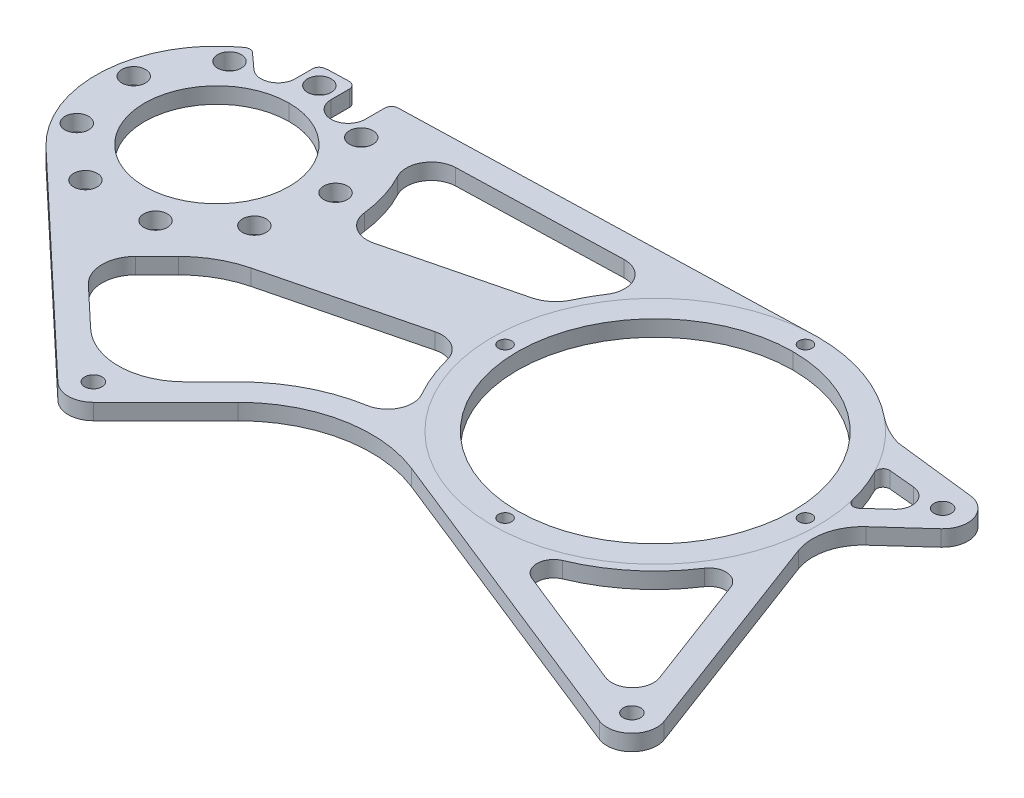
from build123d import *

# Parameters (mm, degrees)
MASTER_SKETCH_R       = 52.451
MASTER_SKETCH_R_2     = 9.525
MASTER_SKETCH_R_3     = 45.974
MASTER_SKETCH_R_4     = 27.4955
MASTER_SKETCH_R_5     = 6.5
BOSS_EXTRUDE2_DEPTH   = 3.048
F_5_0MM_DOWEL_HOLE1_D = 5
CIRPATTERN4_COUNT     = 4
M6_CLEARANCE_HOLE4_D  = 6.6
M8_CLEARANCE_HOLE1_D  = 9
CIRPATTERN3_COUNT     = 9
CUT_EXTRUDE2_DEPTH    = 284.854467488
CUT_EXTRUDE3_DEPTH    = 284.854467488
FILLET1_R             = 2.54


with BuildPart() as part:
    # Master Sketch → Boss-Extrude2 (new, symmetric)
    # profile 1 of 5: a face of its own
    with BuildSketch(Plane(origin=(0, 0, 0), x_dir=(1, 0, 0), z_dir=(0, 1, 0))):
        with BuildLine():
            ThreePointArc((-8.636, 127), (-36.396097826, 84.787887478), (-86.152093601, 93.552952189))
            Line((-86.152093601, 93.552952189), (-6.534964144, 18.470363023))
            ThreePointArc((-6.534964144, 18.470363023), (-3.773598517, 34.145603423), (9.525, 25.4))
            ThreePointArc((9.525, 25.4), (8.799952547, 21.754940307), (6.735192091, 18.664807909))
            Line((6.735192091, 18.664807909), (34.255961574, 46.185577392))
            ThreePointArc((34.255961574, 46.185577392), (59.945142207, 60.02346539), (89.010077776, 57.44457682))
            Line((89.010077776, 57.44457682), (207.987004211, 9.951947906))
            ThreePointArc((207.987004211, 9.951947906), (204.851852042, 25.601533276), (220.43444462, 22.148779315))
            Line((220.43444462, 22.148779315), (189.716874265, 103.891447497))
            ThreePointArc((189.716874265, 103.891447497), (189.0323732, 115.067445458), (194.744907427, 124.697524629))
            Line((194.744907427, 124.697524629), (209.652959731, 138.231042786))
            ThreePointArc((209.652959731, 138.231042786), (194.181291125, 142.373055798), (204.353700493, 154.744429565))
            Line((204.353700493, 154.744429565), (173.100049306, 158.387997533))
            ThreePointArc((173.100049306, 158.387997533), (167.382597042, 160.73155253), (162.227355528, 164.138163067))
            ThreePointArc((162.227355528, 164.138163067), (143.898999717, 174.415513345), (123.19, 177.9778))
            Line((123.19, 177.9778), (-54.61, 172.974))
            ThreePointArc((-54.61, 172.974), (-22.101472842, 159.508527158), (-8.636, 127))
        make_face()
        with Locations(Location((123.19, 116.0018, 0), (0, 0, 90))):
            Circle(MASTER_SKETCH_R, mode=Mode.SUBTRACT)
    # profile 2 of 5: a face of its own
    with BuildSketch(Plane(origin=(0, 0, 0), x_dir=(1, 0, 0), z_dir=(0, 1, 0))):
        with Locations((0, 25.4)):
            Circle(MASTER_SKETCH_R_2)
    # profile 3 of 5: a face of its own
    with BuildSketch(Plane(origin=(0, 0, 0), x_dir=(1, 0, 0), z_dir=(0, 1, 0))):
        with Locations((211.518208908, 18.79820239)):
            Circle(MASTER_SKETCH_R_2)
    # profile 4 of 5: a face of its own
    with BuildSketch(Plane(origin=(0, 0, 0), x_dir=(1, 0, 0), z_dir=(0, 1, 0))):
        with Locations((203.2507406, 145.283504427)):
            Circle(MASTER_SKETCH_R_2)
    # profile 5 of 5: a face of its own
    with BuildSketch(Plane(origin=(0, 0, 0), x_dir=(1, 0, 0), z_dir=(0, 1, 0))):
        with Locations((-54.61, 127)):
            Circle(MASTER_SKETCH_R_3)
        with Locations(Location((-54.61, 127, 0), (0, 0, 90))):
            Circle(MASTER_SKETCH_R_4, mode=Mode.SUBTRACT)
        with Locations(Location((-67.94878559, 163.648012211, 0), (0, 0, 90))):
            Circle(MASTER_SKETCH_R_5, mode=Mode.SUBTRACT)
        with Locations(Location((-41.27121441, 163.648012211, 0), (0, 0, 90))):
            Circle(MASTER_SKETCH_R_5, mode=Mode.SUBTRACT)
    extrude(amount=BOSS_EXTRUDE2_DEPTH, both=True)

    # Ø5.0mm Dowel Hole1 (through all)
    with Locations(Plane(origin=(0, 3.048, 0), x_dir=(1, 0, 0), z_dir=(0, 1, 0))):
        with Locations((123.19, 173.1518)):
            f_5_0mm_dowel_hole1 = Hole(F_5_0MM_DOWEL_HOLE1_D / 2)

    # CirPattern4: Ø5.0mm Dowel Hole1 ×4 about axis
    cirpattern4_axis = Axis((123.19, 0, -116.0018), (0, 1, 0))
    for i in range(1, CIRPATTERN4_COUNT):
        add(f_5_0mm_dowel_hole1.rotate(cirpattern4_axis, i * 360 / CIRPATTERN4_COUNT), mode=Mode.SUBTRACT)

    # M6 Clearance Hole4 (through all)
    with Locations(Plane(origin=(0, 3.048, 0), x_dir=(1, 0, 0), z_dir=(0, 1, 0))):
        with Locations((203.2507406, 145.283504427), (211.518208908, 18.79820239), (0, 25.4)):
            Hole(M6_CLEARANCE_HOLE4_D / 2)

    # M8 Clearance Hole1 (through all)
    with Locations(Plane(origin=(0, 3.048, 0), x_dir=(1, 0, 0), z_dir=(0, 1, 0))):
        with Locations((-54.61, 166)):
            m8_clearance_hole1 = Hole(M8_CLEARANCE_HOLE1_D / 2)

    # CirPattern3: M8 Clearance Hole1 ×9 about axis
    cirpattern3_axis = Axis((-54.61, 0, -127), (0, 1, 0))
    for i in range(1, CIRPATTERN3_COUNT):
        add(m8_clearance_hole1.rotate(cirpattern3_axis, i * 360 / CIRPATTERN3_COUNT), mode=Mode.SUBTRACT)

    # Topology 3 → Cut-Extrude2 (cut, through all)
    with BuildSketch(Plane(origin=(0, 3.048, 0), x_dir=(1, 0, 0), z_dir=(0, 1, 0))):
        with BuildLine():
            ThreePointArc((-17.945313453, 42.323250142), (-0.146601343, 35.405008389), (17.44176984, 42.84176984))
            Line((17.44176984, 42.84176984), (27.520769483, 52.920769483))
            ThreePointArc((27.520769483, 52.920769483), (42.409632623, 63.819008448), (59.896219631, 69.707058463))
            ThreePointArc((59.896219631, 69.707058463), (66.885503662, 75.024623751), (66.553177874, 83.800508404))
            ThreePointArc((66.553177874, 83.800508404), (62.745475764, 91.688999032), (60.030376503, 100.016970919))
            ThreePointArc((60.030376503, 100.016970919), (55.6852269, 105.854731176), (48.48636159, 106.920614917))
            Line((48.48636159, 106.920614917), (-7.457826773, 92.934567826))
            ThreePointArc((-7.457826773, 92.934567826), (-16.98904431, 89.126755018), (-25.157987823, 82.912906934))
            Line((-25.157987823, 82.912906934), (-33.299725858, 74.771168898))
            ThreePointArc((-33.299725858, 74.771168898), (-37.018106584, 65.604842248), (-33.032755262, 56.551396808))
            Line((-33.032755262, 56.551396808), (-17.945313453, 42.323250142))
        make_face()
        with BuildLine():
            ThreePointArc((64.098067009, 143.438932802), (66.306808777, 147.765857633), (68.831828447, 151.916170194))
            ThreePointArc((68.831828447, 151.916170194), (69.209050275, 161.796201373), (60.61677272, 166.688039353))
            Line((60.61677272, 166.688039353), (-1.663792567, 164.935286301))
            ThreePointArc((-1.663792567, 164.935286301), (-9.632748017, 160.197249287), (-9.798074059, 150.927626155))
            ThreePointArc((-9.798074059, 150.927626155), (-6.09260405, 142.056636088), (-4.12477238, 132.646396384))
            ThreePointArc((-4.12477238, 132.646396384), (-0.093621954, 125.882803807), (7.651359628, 124.464488392))
            Line((7.651359628, 124.464488392), (55.659374127, 136.466492017))
            ThreePointArc((55.659374127, 136.466492017), (60.668494681, 138.996854714), (64.098067009, 143.438932802))
        make_face()
        with BuildLine():
            ThreePointArc((148.153589294, 55.823132596), (164.735029841, 65.81551406), (177.648151764, 80.239214699))
            ThreePointArc((177.648151764, 80.239214699), (183.658143307, 83.064639882), (188.900120968, 78.987300553))
            Line((188.900120968, 78.987300553), (205.194131764, 35.627233252))
            ThreePointArc((205.194131764, 35.627233252), (203.319232726, 27.16564341), (194.821264757, 25.463207079))
            Line((194.821264757, 25.463207079), (148.232551201, 44.060262413))
            ThreePointArc((148.232551201, 44.060262413), (144.236830733, 49.915140022), (148.153589294, 55.823132596))
        make_face()
        with BuildLine():
            Line((187.419319265, 129.472737786), (194.351886978, 135.766117303))
            ThreePointArc((194.351886978, 135.766117303), (196.107471775, 142.477028469), (190.674704354, 146.790199554))
            Line((190.674704354, 146.790199554), (180.805871382, 147.712647003))
            ThreePointArc((180.805871382, 147.712647003), (178.552910329, 146.650002513), (178.398012452, 144.16383006))
            ThreePointArc((178.398012452, 144.16383006), (181.288513561, 137.579272003), (183.396839106, 130.704218196))
            ThreePointArc((183.396839106, 130.704218196), (185.057898436, 128.944655397), (187.419319265, 129.472737786))
        make_face()
    extrude(amount=-CUT_EXTRUDE2_DEPTH, mode=Mode.SUBTRACT)

    # Sketch29 → Cut-Extrude3 (cut, through all)
    with BuildSketch(Plane.XZ.offset(3.048)):
        with BuildLine():
            Line((-72.305646266, -158.824345033), (-79.713448931, -165.515263569))
            ThreePointArc((-79.713448931, -165.515263569), (-70.954498766, -169.970525201), (-61.44878559, -172.462508594))
            Line((-61.44878559, -172.462508594), (-61.44878559, -163.648012211))
            ThreePointArc((-61.44878559, -163.648012211), (-70.587952655, -169.588112984), (-72.305646266, -158.824345033))
        make_face()
        with BuildLine():
            Line((-47.77121441, -163.648012211), (-47.77121441, -173.166462966))
            Line((-47.77121441, -173.166462966), (-34.77121441, -173.532320109))
            Line((-34.77121441, -173.532320109), (-34.77121441, -163.648012211))
            ThreePointArc((-34.77121441, -163.648012211), (-41.27121441, -170.148012211), (-47.77121441, -163.648012211))
        make_face()
    extrude(amount=-CUT_EXTRUDE3_DEPTH, mode=Mode.SUBTRACT)

    # Fillet1
    fillet1_edges = [part.edges().sort_by_distance(p)[0] for p in [
        (-79.713448931, 0, -165.515263569),
        (-61.44878559, 0, -172.462508594),
        (-47.77121441, 0, -173.166462966),
        (-34.77121441, 0, -173.532320109),
    ]]
    fillet(fillet1_edges, radius=FILLET1_R)


solid = part.part
